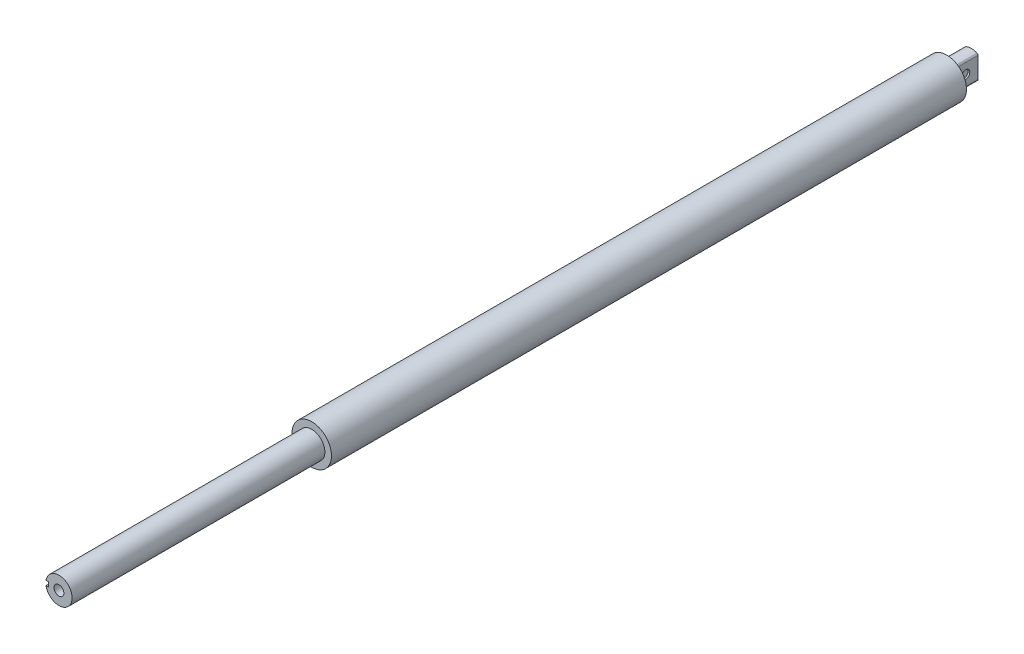
from build123d import *

# Parameters (mm, degrees)
CUT_EXTRUDE2_START = -30
CUT_EXTRUDE2_DEPTH = 30
SKETCH5_R          = 3
CUT_EXTRUDE3_DEPTH = 40
CUT_EXTRUDE4_START = -138.75
SKETCH6_R          = 12
SKETCH6_R_2        = 8
CUT_EXTRUDE4_DEPTH = 138.75
CUT_EXTRUDE5_DEPTH = 15
FILLET1_R          = 1
SKETCH8_R          = 2.5
CUT_EXTRUDE6_DEPTH = 1


with BuildPart() as part:
    # Sketch2 → Revolve2 (revolve)
    with BuildSketch(Plane(origin=(0, 0, 0), x_dir=(1, 0, 0), z_dir=(0, 1, 0)), mode=Mode.PRIVATE) as revolve2_sk:
        Polygon((0, -277.5), (8, -277.5), (8, -262.5), (12, -262.5), (12, 262.5), (8, 262.5), (8, 277.5), (0, 277.5), align=None)
    revolve(revolve2_sk.sketch.rotate(Axis((0, 0, -364.100348117), (0, 0, 1)), 180), axis=Axis((0, 0, -364.100348117), (0, 0, 1)))

    # Sketch4 → Cut-Extrude2 (cut)
    with BuildSketch(Plane.XY.offset(277.5).offset(CUT_EXTRUDE2_START)):
        with BuildLine():
            Line((-6.488318348, 1.39), (-7.878318348, 1.39))
            ThreePointArc((-7.878318348, 1.39), (-8, 0), (-7.878318348, -1.39))
            Line((-7.878318348, -1.39), (-6.488318348, -1.39))
            Line((-6.488318348, -1.39), (-6.488318348, 1.39))
        make_face()
    extrude(amount=CUT_EXTRUDE2_DEPTH, mode=Mode.SUBTRACT)

    # Sketch5 → Cut-Extrude3 (cut)
    with BuildSketch(Plane.XY.offset(277.5)):
        Circle(SKETCH5_R)
    extrude(amount=-CUT_EXTRUDE3_DEPTH, mode=Mode.SUBTRACT)

    # Sketch6 → Cut-Extrude4 (cut)
    with BuildSketch(Plane.XY.offset(262.5).offset(CUT_EXTRUDE4_START)):
        with Locations(Location((0, 0, 0), (0, 0, 180))):
            Circle(SKETCH6_R)
        with Locations(Location((0, 0, 0), (0, 0, 180))):
            Circle(SKETCH6_R_2, mode=Mode.SUBTRACT)
    extrude(amount=CUT_EXTRUDE4_DEPTH, mode=Mode.SUBTRACT)

    # Sketch7 → Cut-Extrude5 (cut)
    with BuildSketch(Plane(origin=(0, 0, -277.5), x_dir=(-1, 0, 0), z_dir=(0, 0, -1))):
        with BuildLine():
            Line((-4, 6.92820323), (-4, -6.92820323))
            ThreePointArc((-4, -6.92820323), (-8, 0), (-4, 6.92820323))
        make_face()
        with BuildLine():
            Line((4, -6.92820323), (4, 6.92820323))
            ThreePointArc((4, 6.92820323), (8, 0), (4, -6.92820323))
        make_face()
    extrude(amount=-CUT_EXTRUDE5_DEPTH, mode=Mode.SUBTRACT)

    # Fillet1
    fillet1_edges = [part.edges().sort_by_distance(p)[0] for p in [
        (4, 6.92820323, -270),
        (4, -6.92820323, -270),
        (-4, -6.92820323, -270),
        (-4, 6.92820323, -270),
    ]]
    fillet(fillet1_edges, radius=FILLET1_R)

    # Sketch8 → Cut-Extrude6 (cut)
    with BuildSketch(Plane(origin=(4, 0, 0), x_dir=(0, 0, -1), z_dir=(1, 0, 0))):
        with Locations((270, 0)):
            Circle(SKETCH8_R)
    extrude(amount=-CUT_EXTRUDE6_DEPTH, mode=Mode.SUBTRACT)


solid = part.part
